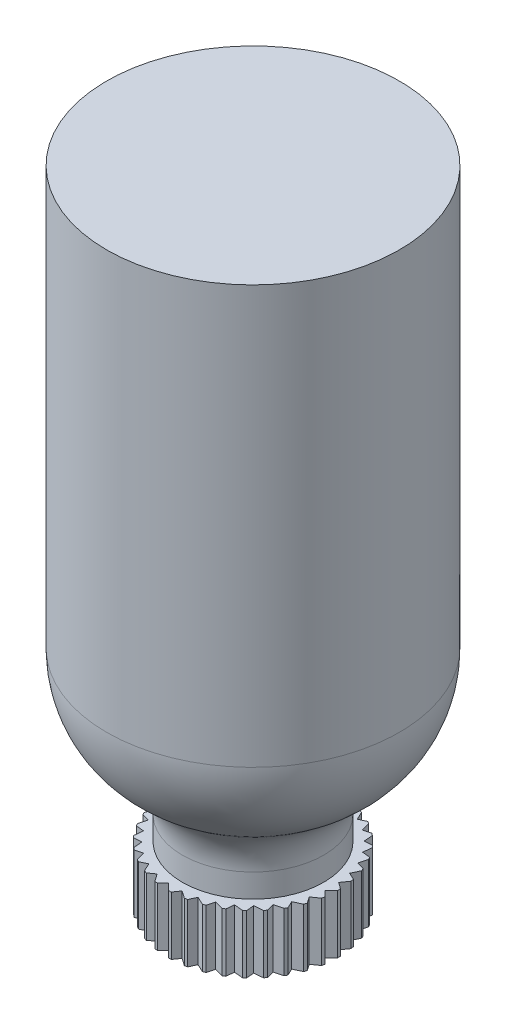
from build123d import *

# Parameters (mm, degrees)
BOSS_EXTRUDE1_DEPTH = 5
FILLET1_R           = 20


with BuildPart() as part:
    # Sketch1 → Boss-Extrude1 (new, symmetric)
    with BuildSketch(Plane(origin=(0, 0, 0), x_dir=(1, 0, 0), z_dir=(0, 1, 0))):
        with BuildLine():
            Line((-13.413143077, 1.086856923), (-14.5, 0))
            ThreePointArc((-14.5, 0), (-14.497902835, -0.246603683), (-14.491611948, -0.493136032))
            Line((-14.491611948, -0.493136032), (-13.398098019, -1.258822728))
            Line((-13.398098019, -1.258822728), (-14.279712419, -2.517898576))
            ThreePointArc((-14.279712419, -2.517898576), (-14.234824835, -2.760391626), (-14.185819627, -3.002086193))
            Line((-14.185819627, -3.002086193), (-12.975958532, -3.566253687))
            Line((-12.975958532, -3.566253687), (-13.625543001, -4.959292078))
            ThreePointArc((-13.625543001, -4.959292078), (-13.539228884, -5.190306466), (-13.448998355, -5.419819485))
            Line((-13.448998355, -5.419819485), (-12.159551111, -5.765325833))
            Line((-12.159551111, -5.765325833), (-12.557368355, -7.25))
            ThreePointArc((-12.557368355, -7.25), (-12.432250316, -7.462516471), (-12.303536073, -7.672874305))
            Line((-12.303536073, -7.672874305), (-10.973681883, -7.789221471))
            Line((-10.973681883, -7.789221471), (-11.107644425, -9.32042034))
            ThreePointArc((-11.107644425, -9.32042034), (-10.947524112, -9.50798169), (-10.784237074, -9.692792721))
            Line((-10.784237074, -9.692792721), (-9.454382883, -9.576445555))
            Line((-9.454382883, -9.576445555), (-9.32042034, -11.107644425))
            ThreePointArc((-9.32042034, -11.107644425), (-9.130162928, -11.264551696), (-8.937264488, -11.418200536))
            Line((-8.937264488, -11.418200536), (-7.647817244, -11.072694188))
            Line((-7.647817244, -11.072694188), (-7.25, -12.557368355))
            ThreePointArc((-7.25, -12.557368355), (-7.035386364, -12.678853998), (-6.818737643, -12.796672105))
            Line((-6.818737643, -12.796672105), (-5.608876548, -12.232504611))
            Line((-5.608876548, -12.232504611), (-4.959292078, -13.625543001))
            ThreePointArc((-4.959292078, -13.625543001), (-4.726843145, -13.707915738), (-4.493026906, -13.786323267))
            Line((-4.493026906, -13.786323267), (-3.399512976, -13.020636571))
            Line((-3.399512976, -13.020636571), (-2.517898576, -14.279712419))
            ThreePointArc((-2.517898576, -14.279712419), (-2.274677189, -14.320469395), (-2.030797819, -14.357083973))
            Line((-2.030797819, -14.357083973), (-1.086856923, -13.413143077))
            Line((-1.086856923, -13.413143077), (0, -14.5))
            ThreePointArc((0, -14.5), (0.246603683, -14.497902835), (0.493136032, -14.491611948))
            Line((0.493136032, -14.491611948), (1.258822728, -13.398098019))
            Line((1.258822728, -13.398098019), (2.517898576, -14.279712419))
            ThreePointArc((2.517898576, -14.279712419), (2.760391626, -14.234824835), (3.002086193, -14.185819627))
            Line((3.002086193, -14.185819627), (3.566253687, -12.975958532))
            Line((3.566253687, -12.975958532), (4.959292078, -13.625543001))
            ThreePointArc((4.959292078, -13.625543001), (5.190306466, -13.539228884), (5.419819485, -13.448998355))
            Line((5.419819485, -13.448998355), (5.765325833, -12.159551111))
            Line((5.765325833, -12.159551111), (7.25, -12.557368355))
            ThreePointArc((7.25, -12.557368355), (7.462516471, -12.432250316), (7.672874305, -12.303536073))
            Line((7.672874305, -12.303536073), (7.789221471, -10.973681883))
            Line((7.789221471, -10.973681883), (9.32042034, -11.107644425))
            ThreePointArc((9.32042034, -11.107644425), (9.50798169, -10.947524112), (9.692792721, -10.784237074))
            Line((9.692792721, -10.784237074), (9.576445555, -9.454382883))
            Line((9.576445555, -9.454382883), (11.107644425, -9.32042034))
            ThreePointArc((11.107644425, -9.32042034), (11.264551696, -9.130162928), (11.418200536, -8.937264488))
            Line((11.418200536, -8.937264488), (11.072694188, -7.647817244))
            Line((11.072694188, -7.647817244), (12.557368355, -7.25))
            ThreePointArc((12.557368355, -7.25), (12.678853998, -7.035386364), (12.796672105, -6.818737643))
            Line((12.796672105, -6.818737643), (12.232504611, -5.608876548))
            Line((12.232504611, -5.608876548), (13.625543001, -4.959292078))
            ThreePointArc((13.625543001, -4.959292078), (13.707915738, -4.726843145), (13.786323267, -4.493026906))
            Line((13.786323267, -4.493026906), (13.020636571, -3.399512976))
            Line((13.020636571, -3.399512976), (14.279712419, -2.517898576))
            ThreePointArc((14.279712419, -2.517898576), (14.320469395, -2.274677189), (14.357083973, -2.030797819))
            Line((14.357083973, -2.030797819), (13.413143077, -1.086856923))
            Line((13.413143077, -1.086856923), (14.5, 0))
            ThreePointArc((14.5, 0), (14.497902835, 0.246603683), (14.491611948, 0.493136032))
            Line((14.491611948, 0.493136032), (13.398098019, 1.258822728))
            Line((13.398098019, 1.258822728), (14.279712419, 2.517898576))
            ThreePointArc((14.279712419, 2.517898576), (14.234824835, 2.760391626), (14.185819627, 3.002086193))
            Line((14.185819627, 3.002086193), (12.975958532, 3.566253687))
            Line((12.975958532, 3.566253687), (13.625543001, 4.959292078))
            ThreePointArc((13.625543001, 4.959292078), (13.539228884, 5.190306466), (13.448998355, 5.419819485))
            Line((13.448998355, 5.419819485), (12.159551111, 5.765325833))
            Line((12.159551111, 5.765325833), (12.557368355, 7.25))
            ThreePointArc((12.557368355, 7.25), (12.432250316, 7.462516471), (12.303536073, 7.672874305))
            Line((12.303536073, 7.672874305), (10.973681883, 7.789221471))
            Line((10.973681883, 7.789221471), (11.107644425, 9.32042034))
            ThreePointArc((11.107644425, 9.32042034), (10.947524112, 9.50798169), (10.784237074, 9.692792721))
            Line((10.784237074, 9.692792721), (9.454382883, 9.576445555))
            Line((9.454382883, 9.576445555), (9.32042034, 11.107644425))
            ThreePointArc((9.32042034, 11.107644425), (9.130162928, 11.264551696), (8.937264488, 11.418200536))
            Line((8.937264488, 11.418200536), (7.647817244, 11.072694188))
            Line((7.647817244, 11.072694188), (7.25, 12.557368355))
            ThreePointArc((7.25, 12.557368355), (7.035386364, 12.678853998), (6.818737643, 12.796672105))
            Line((6.818737643, 12.796672105), (5.608876548, 12.232504611))
            Line((5.608876548, 12.232504611), (4.959292078, 13.625543001))
            ThreePointArc((4.959292078, 13.625543001), (4.726843145, 13.707915738), (4.493026906, 13.786323267))
            Line((4.493026906, 13.786323267), (3.399512976, 13.020636571))
            Line((3.399512976, 13.020636571), (2.517898576, 14.279712419))
            ThreePointArc((2.517898576, 14.279712419), (2.274677189, 14.320469395), (2.030797819, 14.357083973))
            Line((2.030797819, 14.357083973), (1.086856923, 13.413143077))
            Line((1.086856923, 13.413143077), (0, 14.5))
            ThreePointArc((0, 14.5), (-0.246603683, 14.497902835), (-0.493136032, 14.491611948))
            Line((-0.493136032, 14.491611948), (-1.258822728, 13.398098019))
            Line((-1.258822728, 13.398098019), (-2.517898576, 14.279712419))
            ThreePointArc((-2.517898576, 14.279712419), (-2.760391626, 14.234824835), (-3.002086193, 14.185819627))
            Line((-3.002086193, 14.185819627), (-3.566253687, 12.975958532))
            Line((-3.566253687, 12.975958532), (-4.959292078, 13.625543001))
            ThreePointArc((-4.959292078, 13.625543001), (-5.190306466, 13.539228884), (-5.419819485, 13.448998355))
            Line((-5.419819485, 13.448998355), (-5.765325833, 12.159551111))
            Line((-5.765325833, 12.159551111), (-7.25, 12.557368355))
            ThreePointArc((-7.25, 12.557368355), (-7.462516471, 12.432250316), (-7.672874305, 12.303536073))
            Line((-7.672874305, 12.303536073), (-7.789221471, 10.973681883))
            Line((-7.789221471, 10.973681883), (-9.32042034, 11.107644425))
            ThreePointArc((-9.32042034, 11.107644425), (-9.50798169, 10.947524112), (-9.692792721, 10.784237074))
            Line((-9.692792721, 10.784237074), (-9.576445555, 9.454382883))
            Line((-9.576445555, 9.454382883), (-11.107644425, 9.32042034))
            ThreePointArc((-11.107644425, 9.32042034), (-11.264551696, 9.130162928), (-11.418200536, 8.937264488))
            Line((-11.418200536, 8.937264488), (-11.072694188, 7.647817244))
            Line((-11.072694188, 7.647817244), (-12.557368355, 7.25))
            ThreePointArc((-12.557368355, 7.25), (-12.678853998, 7.035386364), (-12.796672105, 6.818737643))
            Line((-12.796672105, 6.818737643), (-12.232504611, 5.608876548))
            Line((-12.232504611, 5.608876548), (-13.625543001, 4.959292078))
            ThreePointArc((-13.625543001, 4.959292078), (-13.707915738, 4.726843145), (-13.786323267, 4.493026906))
            Line((-13.786323267, 4.493026906), (-13.020636571, 3.399512976))
            Line((-13.020636571, 3.399512976), (-14.279712419, 2.517898576))
            ThreePointArc((-14.279712419, 2.517898576), (-14.320469395, 2.274677189), (-14.357083973, 2.030797819))
            Line((-14.357083973, 2.030797819), (-13.413143077, 1.086856923))
        make_face()
    extrude(amount=BOSS_EXTRUDE1_DEPTH, both=True)

    # Sketch2 → Revolve1 (revolve)
    with BuildSketch(Plane(origin=(0, 0, 0), x_dir=(0, 0, -1), z_dir=(1, 0, 0)), mode=Mode.PRIVATE) as revolve1_sk:
        with BuildLine():
            Line((22.10493006, 19.026987327), (25.061867778, 19.026987327))
            Line((25.061867778, 19.026987327), (25.061867778, 105.264393418))
            Line((25.061867778, 105.264393418), (0, 105.264393418))
            Line((0, 105.264393418), (0, 0))
            Line((0, 0), (12.10493006, 0))
            Line((12.10493006, 0), (12.10493006, 9.026987327))
            ThreePointArc((12.10493006, 9.026987327), (15.033862249, 16.098055139), (22.10493006, 19.026987327))
        make_face()
    revolve(revolve1_sk.sketch.rotate(Axis((0, 105.264393418, 0), (0, -1, 0)), 180), axis=Axis((0, 105.264393418, 0), (0, -1, 0)))

    # Fillet1
    fillet1_edges = [part.edges().sort_by_distance(p)[0] for p in [
        (0, 19.026987327, -25.061867778),
    ]]
    fillet(fillet1_edges, radius=FILLET1_R)


solid = part.part
